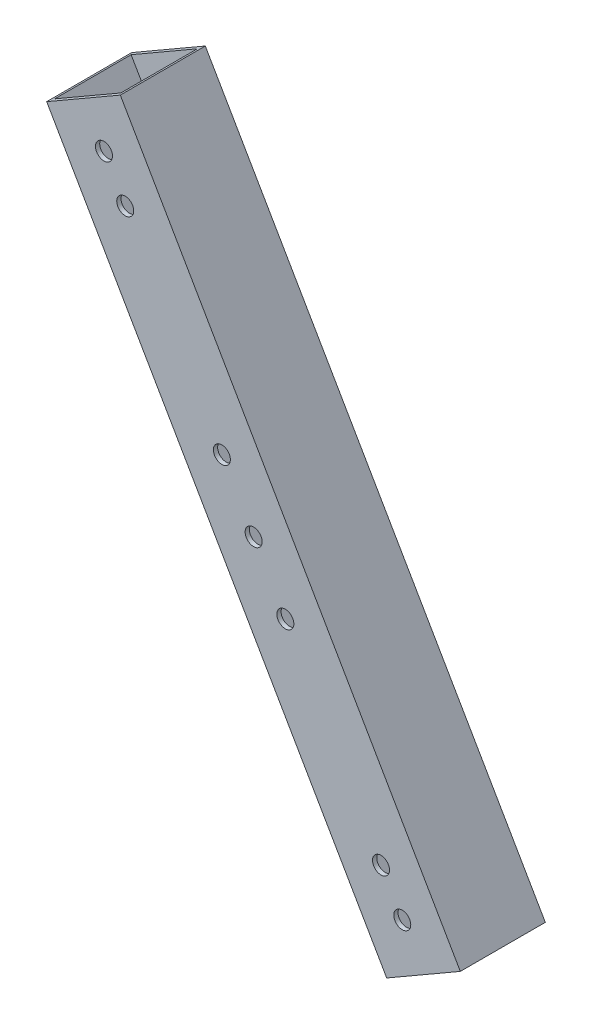
from build123d import *

# Parameters (mm, degrees)
SKETCH_1_R          = 2
EXTRUDE_1_DEPTH     = 20
SKETCH_2_W          = 18
SKETCH_2_H          = 18
CUT_EXTRUDE_1_DEPTH = 170.907643096


with BuildPart() as part:
    # 草图1 → 凸台-拉伸1 (new body)
    with BuildSketch(Plane.XY):
        Polygon((-48.727120284, 63.847904192), (31.272879716, -74.716160413), (48.593387792, -64.716160413), (-31.406612208, 73.847904192), align=None)
        with Locations((-35.246358171, 60.498539287)):
            Circle(SKETCH_1_R, mode=Mode.SUBTRACT)
        with Locations((-30.246358171, 51.838285249)):
            Circle(SKETCH_1_R, mode=Mode.SUBTRACT)
        with Locations((-7.501863714, 12.528261216)):
            Circle(SKETCH_1_R, mode=Mode.SUBTRACT)
        with Locations((-0.037744838, -0.482835818)):
            Circle(SKETCH_1_R, mode=Mode.SUBTRACT)
        with Locations((7.426374037, -13.493932851)):
            Circle(SKETCH_1_R, mode=Mode.SUBTRACT)
        with Locations((29.933133754, -52.395652337)):
            Circle(SKETCH_1_R, mode=Mode.SUBTRACT)
        with Locations((34.933133754, -61.055906375)):
            Circle(SKETCH_1_R, mode=Mode.SUBTRACT)
    extrude(amount=EXTRUDE_1_DEPTH)

    # 草图2 → 切除-拉伸1 (cut, through all)
    with BuildSketch(Plane(origin=(-39.828733576, 68.985390154, 0), x_dir=(0.8660254037844417, 0.4999999999999949, 0), z_dir=(-0.4999999999999949, 0.8660254037844417, 0))):
        with Locations((-0.274971923, -10)):
            Rectangle(SKETCH_2_W, SKETCH_2_H)
    extrude(amount=-CUT_EXTRUDE_1_DEPTH, mode=Mode.SUBTRACT)


solid = part.part
